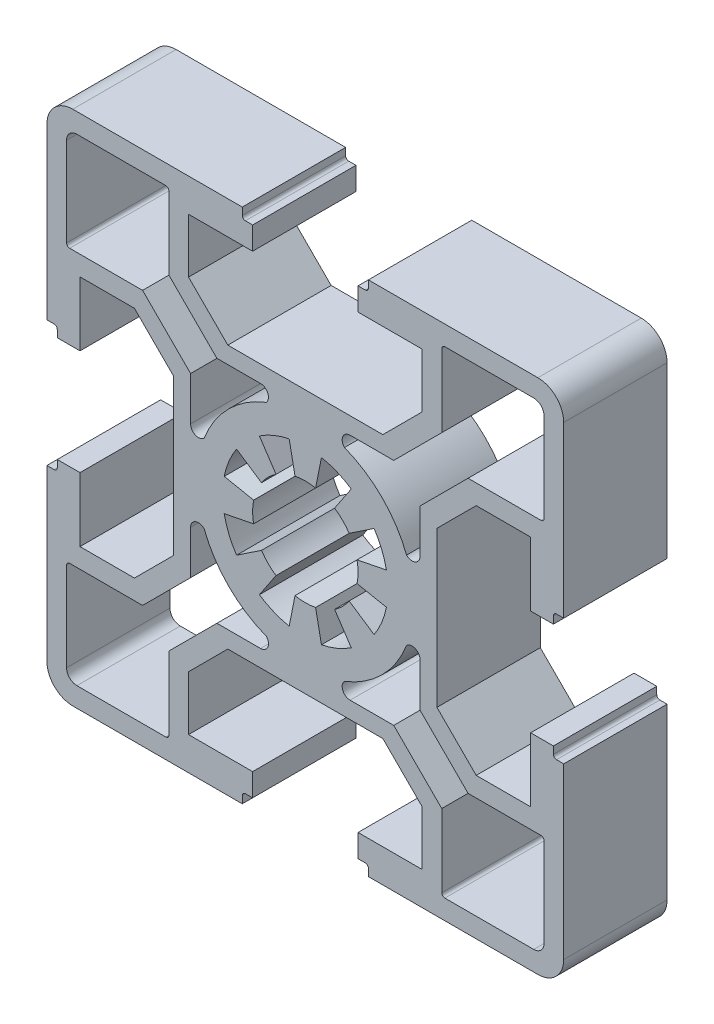
from build123d import *

# Parameters (mm, degrees)
EXTRUDE_1_DEPTH = 10


with BuildPart() as part:
    # 草图1 → 凸台-拉伸1 (new body)
    with BuildSketch(Plane.XY):
        with BuildLine():
            Line((20.642127896, 2.302957359), (24.442127896, 6.102957359))
            Line((24.442127896, 6.102957359), (29.709537715, 6.102957359))
            Line((29.709537715, 6.102957359), (29.709537715, -0.097042641))
            Line((29.709537715, -0.097042641), (31.909537715, -0.097042641))
            Line((31.909537715, -0.097042641), (31.909537715, 0.602957359))
            ThreePointArc((31.909537715, 0.602957359), (31.997405681, 0.815089393), (32.209537715, 0.902957359))
            Line((32.209537715, 0.902957359), (32.909537715, 0.902957359))
            Line((32.909537715, 0.902957359), (32.909537715, 17.302957359))
            ThreePointArc((32.909537715, 17.302957359), (32.177304668, 19.070724312), (30.409537715, 19.802957359))
            Line((30.409537715, 19.802957359), (14.009537715, 19.802957359))
            Line((14.009537715, 19.802957359), (14.009537715, 19.102957359))
            ThreePointArc((14.009537715, 19.102957359), (13.92166975, 18.890825325), (13.709537715, 18.802957359))
            Line((13.709537715, 18.802957359), (13.009537715, 18.802957359))
            Line((13.009537715, 18.802957359), (13.009537715, 16.602957359))
            Line((13.009537715, 16.602957359), (19.209537715, 16.602957359))
            Line((19.209537715, 16.602957359), (19.209537715, 11.33554754))
            Line((19.209537715, 11.33554754), (15.409537715, 7.53554754))
            Line((15.409537715, 7.53554754), (7.909537715, 7.53554754))
            Line((7.909537715, 7.53554754), (0.409537715, 7.53554754))
            Line((0.409537715, 7.53554754), (-3.390462285, 11.33554754))
            Line((-3.390462285, 11.33554754), (-3.390462285, 16.602957359))
            Line((-3.390462285, 16.602957359), (2.809537715, 16.602957359))
            Line((2.809537715, 16.602957359), (2.809537715, 18.802957359))
            Line((2.809537715, 18.802957359), (2.109537715, 18.802957359))
            ThreePointArc((2.109537715, 18.802957359), (1.897405681, 18.890825325), (1.809537715, 19.102957359))
            Line((1.809537715, 19.102957359), (1.809537715, 19.802957359))
            Line((1.809537715, 19.802957359), (-14.590462285, 19.802957359))
            ThreePointArc((-14.590462285, 19.802957359), (-16.358229238, 19.070724312), (-17.090462285, 17.302957359))
            Line((-17.090462285, 17.302957359), (-17.090462285, 0.902957359))
            Line((-17.090462285, 0.902957359), (-16.390462285, 0.902957359))
            ThreePointArc((-16.390462285, 0.902957359), (-16.17833025, 0.815089393), (-16.090462285, 0.602957359))
            Line((-16.090462285, 0.602957359), (-16.090462285, -0.097042641))
            Line((-16.090462285, -0.097042641), (-13.890462285, -0.097042641))
            Line((-13.890462285, -0.097042641), (-13.890462285, 6.102957359))
            Line((-13.890462285, 6.102957359), (-8.623052466, 6.102957359))
            Line((-8.623052466, 6.102957359), (-4.823052466, 2.302957359))
            Line((-4.823052466, 2.302957359), (-4.823052466, -5.197042641))
            Line((-4.823052466, -5.197042641), (-4.823052466, -12.697042641))
            Line((-4.823052466, -12.697042641), (-8.623052466, -16.497042641))
            Line((-8.623052466, -16.497042641), (-13.890462285, -16.497042641))
            Line((-13.890462285, -16.497042641), (-13.890462285, -10.297042641))
            Line((-13.890462285, -10.297042641), (-16.090462285, -10.297042641))
            Line((-16.090462285, -10.297042641), (-16.090462285, -10.997042641))
            ThreePointArc((-16.090462285, -10.997042641), (-16.17833025, -11.209174675), (-16.390462285, -11.297042641))
            Line((-16.390462285, -11.297042641), (-17.090462285, -11.297042641))
            Line((-17.090462285, -11.297042641), (-17.090462285, -27.697042641))
            ThreePointArc((-17.090462285, -27.697042641), (-16.358229238, -29.464809594), (-14.590462285, -30.197042641))
            Line((-14.590462285, -30.197042641), (1.809537715, -30.197042641))
            Line((1.809537715, -30.197042641), (1.809537715, -29.497042641))
            ThreePointArc((1.809537715, -29.497042641), (1.897405681, -29.284910607), (2.109537715, -29.197042641))
            Line((2.109537715, -29.197042641), (2.809537715, -29.197042641))
            Line((2.809537715, -29.197042641), (2.809537715, -26.997042641))
            Line((2.809537715, -26.997042641), (-3.390462285, -26.997042641))
            Line((-3.390462285, -26.997042641), (-3.390462285, -21.729632822))
            Line((-3.390462285, -21.729632822), (0.409537715, -17.929632822))
            Line((0.409537715, -17.929632822), (7.909537715, -17.929632822))
            Line((7.909537715, -17.929632822), (15.409537715, -17.929632822))
            Line((15.409537715, -17.929632822), (19.209537715, -21.729632822))
            Line((19.209537715, -21.729632822), (19.209537715, -26.997042641))
            Line((19.209537715, -26.997042641), (13.009537715, -26.997042641))
            Line((13.009537715, -26.997042641), (13.009537715, -29.197042641))
            Line((13.009537715, -29.197042641), (13.709537715, -29.197042641))
            ThreePointArc((13.709537715, -29.197042641), (13.92166975, -29.284910607), (14.009537715, -29.497042641))
            Line((14.009537715, -29.497042641), (14.009537715, -30.197042641))
            Line((14.009537715, -30.197042641), (30.409537715, -30.197042641))
            ThreePointArc((30.409537715, -30.197042641), (32.177304668, -29.464809594), (32.909537715, -27.697042641))
            Line((32.909537715, -27.697042641), (32.909537715, -11.297042641))
            Line((32.909537715, -11.297042641), (32.209537715, -11.297042641))
            ThreePointArc((32.209537715, -11.297042641), (31.997405681, -11.209174675), (31.909537715, -10.997042641))
            Line((31.909537715, -10.997042641), (31.909537715, -10.297042641))
            Line((31.909537715, -10.297042641), (29.709537715, -10.297042641))
            Line((29.709537715, -10.297042641), (29.709537715, -16.497042641))
            Line((29.709537715, -16.497042641), (24.442127896, -16.497042641))
            Line((24.442127896, -16.497042641), (20.642127896, -12.697042641))
            Line((20.642127896, -12.697042641), (20.642127896, -5.197042641))
            Line((20.642127896, -5.197042641), (20.642127896, 2.302957359))
        make_face()
        with BuildLine():
            Line((19.009537715, -9.529128657), (19.009537715, -13.751458229))
            Line((19.009537715, -13.751458229), (23.655122127, -18.397042641))
            Line((23.655122127, -18.397042641), (30.709537715, -18.397042641))
            ThreePointArc((30.709537715, -18.397042641), (30.92166975, -18.484910607), (31.009537715, -18.697042641))
            Line((31.009537715, -18.697042641), (31.009537715, -27.297042641))
            ThreePointArc((31.009537715, -27.297042641), (30.716644496, -28.004149422), (30.009537715, -28.297042641))
            Line((30.009537715, -28.297042641), (21.409537715, -28.297042641))
            ThreePointArc((21.409537715, -28.297042641), (21.197405681, -28.209174675), (21.109537715, -27.997042641))
            Line((21.109537715, -27.997042641), (21.109537715, -20.942627053))
            Line((21.109537715, -20.942627053), (16.463953303, -16.297042641))
            Line((16.463953303, -16.297042641), (12.241623731, -16.297042641))
            ThreePointArc((12.241623731, -16.297042641), (11.533669959, -15.826207712), (11.694143716, -14.991263254))
            ThreePointArc((11.694143716, -14.991263254), (15.334158918, -12.621663843), (17.703758328, -8.981648642))
            ThreePointArc((17.703758328, -8.981648642), (18.538702786, -8.821174885), (19.009537715, -9.529128657))
        make_face(mode=Mode.SUBTRACT)
        with BuildLine():
            Line((12.241623731, 5.902957359), (16.463953303, 5.902957359))
            Line((16.463953303, 5.902957359), (21.109537715, 10.548541771))
            Line((21.109537715, 10.548541771), (21.109537715, 17.602957359))
            ThreePointArc((21.109537715, 17.602957359), (21.197405681, 17.815089393), (21.409537715, 17.902957359))
            Line((21.409537715, 17.902957359), (30.009537715, 17.902957359))
            ThreePointArc((30.009537715, 17.902957359), (30.716644496, 17.61006414), (31.009537715, 16.902957359))
            Line((31.009537715, 16.902957359), (31.009537715, 8.302957359))
            ThreePointArc((31.009537715, 8.302957359), (30.92166975, 8.090825325), (30.709537715, 8.002957359))
            Line((30.709537715, 8.002957359), (23.655122127, 8.002957359))
            Line((23.655122127, 8.002957359), (19.009537715, 3.357372947))
            Line((19.009537715, 3.357372947), (19.009537715, -0.864956625))
            ThreePointArc((19.009537715, -0.864956625), (18.538702786, -1.572910397), (17.703758328, -1.41243664))
            ThreePointArc((17.703758328, -1.41243664), (15.334158918, 2.227578561), (11.694143716, 4.597177972))
            ThreePointArc((11.694143716, 4.597177972), (11.533669959, 5.43212243), (12.241623731, 5.902957359))
        make_face(mode=Mode.SUBTRACT)
        with BuildLine():
            Line((3.577451699, -16.297042641), (-0.644877873, -16.297042641))
            Line((-0.644877873, -16.297042641), (-5.290462285, -20.942627053))
            Line((-5.290462285, -20.942627053), (-5.290462285, -27.997042641))
            ThreePointArc((-5.290462285, -27.997042641), (-5.37833025, -28.209174675), (-5.590462285, -28.297042641))
            Line((-5.590462285, -28.297042641), (-14.190462285, -28.297042641))
            ThreePointArc((-14.190462285, -28.297042641), (-14.897569066, -28.004149422), (-15.190462285, -27.297042641))
            Line((-15.190462285, -27.297042641), (-15.190462285, -18.697042641))
            ThreePointArc((-15.190462285, -18.697042641), (-15.102594319, -18.484910607), (-14.890462285, -18.397042641))
            Line((-14.890462285, -18.397042641), (-7.836046697, -18.397042641))
            Line((-7.836046697, -18.397042641), (-3.190462285, -13.751458229))
            Line((-3.190462285, -13.751458229), (-3.190462285, -9.529128657))
            ThreePointArc((-3.190462285, -9.529128657), (-2.719627356, -8.821174885), (-1.884682898, -8.981648642))
            ThreePointArc((-1.884682898, -8.981648642), (0.484916513, -12.621663843), (4.124931715, -14.991263254))
            ThreePointArc((4.124931715, -14.991263254), (4.285405471, -15.826207712), (3.577451699, -16.297042641))
        make_face(mode=Mode.SUBTRACT)
        with BuildLine():
            Line((1.257780817, -0.752480777), (3.669042692, -2.363634453))
            ThreePointArc((3.669042692, -2.363634453), (4.303293131, -1.590798057), (5.076129527, -0.956547618))
            Line((5.076129527, -0.956547618), (3.464975851, 1.454714257))
            ThreePointArc((3.464975851, 1.454714257), (4.848070256, 2.193993619), (6.348815139, 2.649239602))
            Line((6.348815139, 2.649239602), (6.914577073, -0.195037711))
            ThreePointArc((6.914577073, -0.195037711), (7.909537715, -0.097042641), (8.904498357, -0.195037711))
            Line((8.904498357, -0.195037711), (9.470260291, 2.649239602))
            ThreePointArc((9.470260291, 2.649239602), (10.971005174, 2.193993619), (12.354099579, 1.454714257))
            Line((12.354099579, 1.454714257), (10.742945904, -0.956547618))
            ThreePointArc((10.742945904, -0.956547618), (11.515782299, -1.590798057), (12.150032738, -2.363634453))
            Line((12.150032738, -2.363634453), (14.561294614, -0.752480777))
            ThreePointArc((14.561294614, -0.752480777), (15.300573975, -2.135575182), (15.755819958, -3.636320065))
            Line((15.755819958, -3.636320065), (12.911542645, -4.202081999))
            ThreePointArc((12.911542645, -4.202081999), (13.009537715, -5.197042641), (12.911542645, -6.192003283))
            Line((12.911542645, -6.192003283), (15.755819958, -6.757765217))
            ThreePointArc((15.755819958, -6.757765217), (15.300573975, -8.2585101), (14.561294614, -9.641604505))
            Line((14.561294614, -9.641604505), (12.150032738, -8.030450829))
            ThreePointArc((12.150032738, -8.030450829), (11.515782299, -8.803287225), (10.742945904, -9.437537664))
            Line((10.742945904, -9.437537664), (12.354099579, -11.848799539))
            ThreePointArc((12.354099579, -11.848799539), (10.971005174, -12.588078901), (9.470260291, -13.043324884))
            Line((9.470260291, -13.043324884), (8.904498357, -10.199047571))
            ThreePointArc((8.904498357, -10.199047571), (7.909537715, -10.297042641), (6.914577073, -10.199047571))
            Line((6.914577073, -10.199047571), (6.348815139, -13.043324884))
            ThreePointArc((6.348815139, -13.043324884), (4.848070256, -12.588078901), (3.464975851, -11.848799539))
            Line((3.464975851, -11.848799539), (5.076129527, -9.437537664))
            ThreePointArc((5.076129527, -9.437537664), (4.303293131, -8.803287225), (3.669042692, -8.030450829))
            Line((3.669042692, -8.030450829), (1.257780817, -9.641604505))
            ThreePointArc((1.257780817, -9.641604505), (0.518501455, -8.2585101), (0.063255472, -6.757765217))
            Line((0.063255472, -6.757765217), (2.907532785, -6.192003283))
            ThreePointArc((2.907532785, -6.192003283), (2.809537715, -5.197042641), (2.907532785, -4.202081999))
            Line((2.907532785, -4.202081999), (0.063255472, -3.636320065))
            ThreePointArc((0.063255472, -3.636320065), (0.518501455, -2.135575182), (1.257780817, -0.752480777))
        make_face(mode=Mode.SUBTRACT)
        with BuildLine():
            Line((-3.190462285, -0.864956625), (-3.190462285, 3.357372947))
            Line((-3.190462285, 3.357372947), (-7.836046697, 8.002957359))
            Line((-7.836046697, 8.002957359), (-14.890462285, 8.002957359))
            ThreePointArc((-14.890462285, 8.002957359), (-15.102594319, 8.090825325), (-15.190462285, 8.302957359))
            Line((-15.190462285, 8.302957359), (-15.190462285, 16.902957359))
            ThreePointArc((-15.190462285, 16.902957359), (-14.897569066, 17.61006414), (-14.190462285, 17.902957359))
            Line((-14.190462285, 17.902957359), (-5.590462285, 17.902957359))
            ThreePointArc((-5.590462285, 17.902957359), (-5.37833025, 17.815089393), (-5.290462285, 17.602957359))
            Line((-5.290462285, 17.602957359), (-5.290462285, 10.548541771))
            Line((-5.290462285, 10.548541771), (-0.644877873, 5.902957359))
            Line((-0.644877873, 5.902957359), (3.577451699, 5.902957359))
            ThreePointArc((3.577451699, 5.902957359), (4.285405471, 5.43212243), (4.124931715, 4.597177972))
            ThreePointArc((4.124931715, 4.597177972), (0.484916513, 2.227578561), (-1.884682898, -1.41243664))
            ThreePointArc((-1.884682898, -1.41243664), (-2.719627356, -1.572910397), (-3.190462285, -0.864956625))
        make_face(mode=Mode.SUBTRACT)
    extrude(amount=EXTRUDE_1_DEPTH)


solid = part.part
